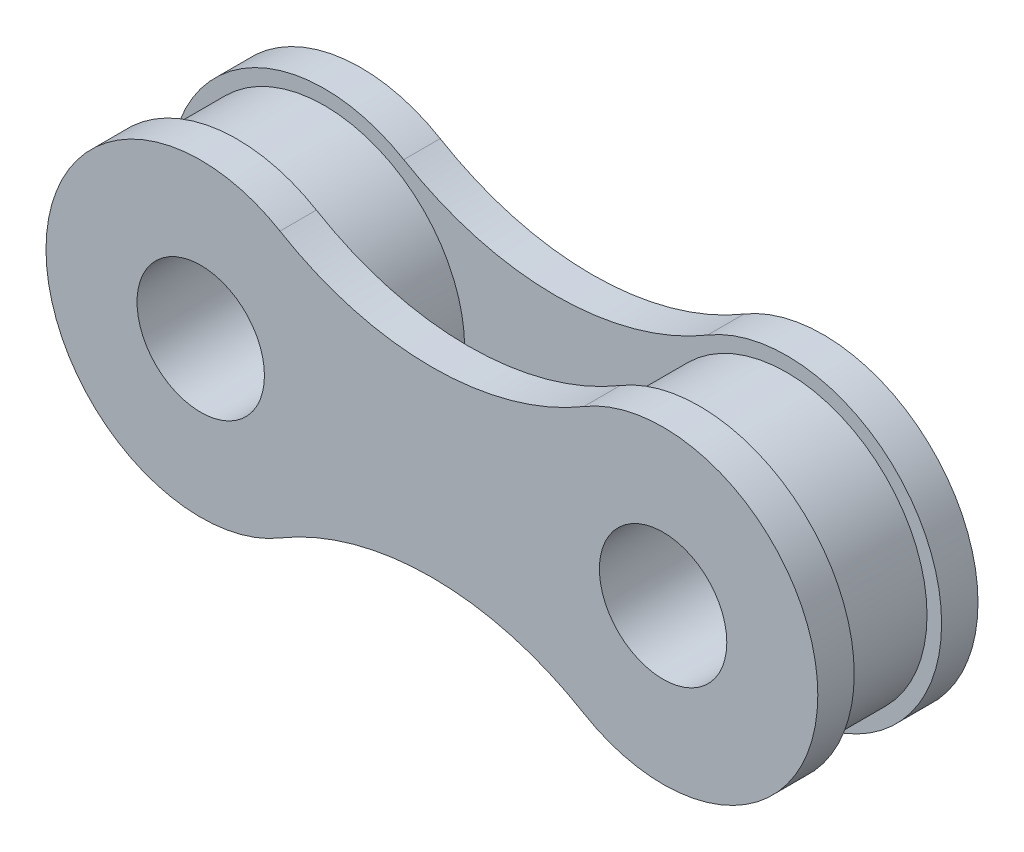
from build123d import *

# Parameters (mm, degrees)
SKETCH1_R           = 1.75
BOSS_EXTRUDE1_DEPTH = 1
BOSS_EXTRUDE3_REACH = 19.802
SKETCH4_R           = 3.85
SKETCH4_R_2         = 1.75


with BuildPart() as part:
    # Sketch1 → Boss-Extrude1 (new body)
    with BuildSketch(Plane.XY):
        with BuildLine():
            ThreePointArc((2.177163766, 3.649994238), (-4.25, 0), (2.177163766, -3.649994238))
            ThreePointArc((2.177163766, -3.649994238), (6.35, -2.5), (10.522836234, -3.649994238))
            ThreePointArc((10.522836234, -3.649994238), (16.95, 0), (10.522836234, 3.649994238))
            ThreePointArc((10.522836234, 3.649994238), (6.35, 2.5), (2.177163766, 3.649994238))
        make_face()
        Circle(SKETCH1_R, mode=Mode.SUBTRACT)
        with Locations((12.7, 0)):
            Circle(SKETCH1_R, mode=Mode.SUBTRACT)
    extrude(amount=BOSS_EXTRUDE1_DEPTH)


with BuildPart() as body_2:
    # Body-Move/Copy1: copy of part
    add(part.part.moved(Location((0, 0, 3.4))))

    # Sketch4 → Boss-Extrude3 (add, up to next)
    with BuildSketch(Plane.XY.offset(1), mode=Mode.PRIVATE) as boss_extrude3_sk1:
        Circle(SKETCH4_R)
        Circle(SKETCH4_R_2, mode=Mode.SUBTRACT)
    boss_extrude3_tool1 = extrude(boss_extrude3_sk1.sketch, amount=BOSS_EXTRUDE3_REACH, mode=Mode.PRIVATE) - body_2.part
    # Sketch4 → Boss-Extrude3 (add, up to next)
    with BuildSketch(Plane.XY.offset(1), mode=Mode.PRIVATE) as boss_extrude3_sk2:
        with Locations((12.7, 0)):
            Circle(SKETCH4_R)
        with Locations((12.7, 0)):
            Circle(SKETCH4_R_2, mode=Mode.SUBTRACT)
    boss_extrude3_tool2 = extrude(boss_extrude3_sk2.sketch, amount=BOSS_EXTRUDE3_REACH, mode=Mode.PRIVATE) - body_2.part

    add(part.part)  # Boss-Extrude3 merges part
    add(boss_extrude3_tool1.solids().sort_by_distance((-3.741106, 0, 1))[0])
    add(boss_extrude3_tool2.solids().sort_by_distance((8.958894, 0, 1))[0])


solid = body_2.part
